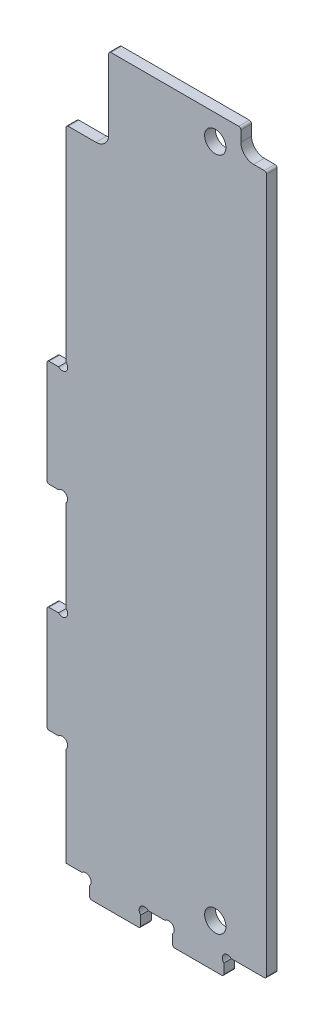
from build123d import *

# Parameters (mm, degrees)
SKETCH1_R           = 2.5
BOSS_EXTRUDE1_DEPTH = 2.5
SKETCH3_W           = 6
SKETCH3_H           = 6
CUT_EXTRUDE2_DEPTH  = 177.395152995
SKETCH2_R           = 1.25
CUT_EXTRUDE1_DEPTH  = 177.395152995
FILLET1_R           = 0.5
FILLET2_R           = 3


with BuildPart() as part:
    # Sketch1 → Boss-Extrude1 (new body)
    with BuildSketch(Plane.XY):
        Polygon((0, 0), (5.5, 0), (5.5, -4.5), (17.5, -4.5), (17.5, 0), (25, 0), (25, -4.5), (37, -4.5), (37, 0), (47, 0), (47, 170), (10, 170), (10, 150), (0, 150), (0, 100), (-4.5, 100), (-4.5, 75), (0, 75), (0, 50), (-4.5, 50), (-4.5, 25), (0, 25), align=None)
        with Locations((35, 5.85)):
            Circle(SKETCH1_R, mode=Mode.SUBTRACT)
        with Locations((35, 164.15)):
            Circle(SKETCH1_R, mode=Mode.SUBTRACT)
    extrude(amount=BOSS_EXTRUDE1_DEPTH)

    # Sketch3 → Cut-Extrude2 (cut, through all)
    with BuildSketch(Plane.XY.offset(2.5)):
        with Locations((44, 167)):
            Rectangle(SKETCH3_W, SKETCH3_H)
    extrude(amount=-CUT_EXTRUDE2_DEPTH, mode=Mode.SUBTRACT)

    # Sketch2 → Cut-Extrude1 (cut, through all)
    with BuildSketch(Plane.XY.offset(2.5)):
        with Locations((-0.883883476, 24.116116524)):
            Circle(SKETCH2_R)
        with Locations((-0.883883476, 50.883883476)):
            Circle(SKETCH2_R)
        with Locations((-0.883883476, 74.116116524)):
            Circle(SKETCH2_R)
        with Locations((-0.883883476, 100.883883476)):
            Circle(SKETCH2_R)
        with Locations((4.616116524, -0.883883476)):
            Circle(SKETCH2_R)
        with Locations((18.383883476, -0.883883476)):
            Circle(SKETCH2_R)
        with Locations((24.116116524, -0.883883476)):
            Circle(SKETCH2_R)
        with Locations((37.883883476, -0.883883476)):
            Circle(SKETCH2_R)
    extrude(amount=-CUT_EXTRUDE1_DEPTH, mode=Mode.SUBTRACT)

    # Fillet1
    fillet1_edges = [part.edges().sort_by_distance(p)[0] for p in [
        (-4.5, 25, 1.25),
        (-4.5, 50, 1.25),
        (-4.5, 75, 1.25),
        (-4.5, 100, 1.25),
        (0, 150, 1.25),
        (10, 170, 1.25),
        (47, 0, 1.25),
        (37, -4.5, 1.25),
        (25, -4.5, 1.25),
        (17.5, -4.5, 1.25),
        (5.5, -4.5, 1.25),
        (41, 170, 1.25),
        (47, 164, 1.25),
    ]]
    fillet(fillet1_edges, radius=FILLET1_R)

    # Fillet2
    fillet2_edges = [part.edges().sort_by_distance(p)[0] for p in [
        (10, 150, 1.25),
        (41, 164, 1.25),
    ]]
    fillet(fillet2_edges, radius=FILLET2_R)


solid = part.part
